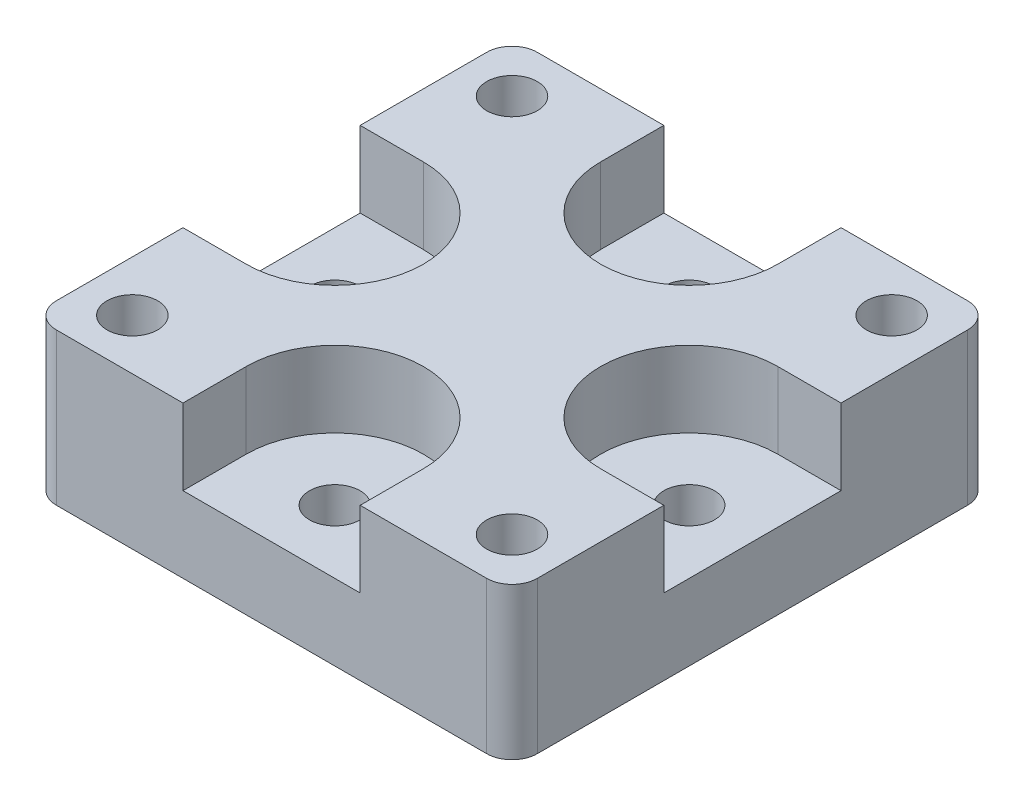
from build123d import *

# Parameters (mm, degrees)
SKETCH_1_W          = 19
SKETCH_1_H          = 19
SKETCH_1_R          = 1
EXTRUDE_1_DEPTH     = 6
FILLET_1_R          = 1
SKETCH_2_R          = 1
CUT_EXTRUDE_1_DEPTH = 28.531799796
CUT_EXTRUDE_2_DEPTH = 3


with BuildPart() as part:
    # Эскиз1 → Бобышка-Вытянуть1 (new body)
    with BuildSketch(Plane(origin=(0, 0, 0), x_dir=(1, 0, 0), z_dir=(0, 1, 0))):
        with Locations((9.5, 9.5)):
            Rectangle(SKETCH_1_W, SKETCH_1_H)
        with Locations(Location((2, 17, 0), (0, 0, 270))):
            Circle(SKETCH_1_R, mode=Mode.SUBTRACT)
        with Locations(Location((17, 17, 0), (0, 0, 270))):
            Circle(SKETCH_1_R, mode=Mode.SUBTRACT)
        with Locations(Location((17, 2, 0), (0, 0, 270))):
            Circle(SKETCH_1_R, mode=Mode.SUBTRACT)
        with Locations(Location((2, 2, 0), (0, 0, 270))):
            Circle(SKETCH_1_R, mode=Mode.SUBTRACT)
    extrude(amount=EXTRUDE_1_DEPTH)

    # Скругление1
    fillet_1_edges = [part.edges().sort_by_distance(p)[0] for p in [
        (0, 3, -19),
        (19, 3, -19),
        (19, 3, 0),
        (0, 3, 0),
    ]]
    fillet(fillet_1_edges, radius=FILLET_1_R)

    # Эскиз2 → Вырез-Вытянуть1 (cut, through all)
    with BuildSketch(Plane(origin=(0, 6, 0), x_dir=(1, 0, 0), z_dir=(0, 1, 0))):
        with Locations(Location((9.5, 16.5, 0), (0, 0, 270))):
            Circle(SKETCH_2_R)
        with Locations(Location((16.5, 9.5, 0), (0, 0, 270))):
            Circle(SKETCH_2_R)
        with Locations(Location((9.5, 2.5, 0), (0, 0, 270))):
            Circle(SKETCH_2_R)
        with Locations(Location((2.5, 9.5, 0), (0, 0, 270))):
            Circle(SKETCH_2_R)
    extrude(amount=-CUT_EXTRUDE_1_DEPTH, mode=Mode.SUBTRACT)

    # Эскиз3 → Вырез-Вытянуть2 (cut)
    with BuildSketch(Plane(origin=(0, 6, 0), x_dir=(1, 0, 0), z_dir=(0, 1, 0))):
        with BuildLine():
            Line((6, 16.5), (6, 21.9359466))
            Line((6, 21.9359466), (13, 21.9359466))
            Line((13, 21.9359466), (13, 16.5))
            ThreePointArc((13, 16.5), (9.5, 13), (6, 16.5))
        make_face()
        with BuildLine():
            Line((13, 2.5), (13, -5.102937302))
            Line((13, -5.102937302), (6, -4.799159297))
            Line((6, -4.799159297), (6, 2.5))
            ThreePointArc((6, 2.5), (9.5, 6), (13, 2.5))
        make_face()
        with BuildLine():
            Line((2.5, 6), (-3.698936954, 6))
            Line((-3.698936954, 6), (-3.698936954, 13))
            Line((-3.698936954, 13), (2.5, 13))
            ThreePointArc((2.5, 13), (6, 9.5), (2.5, 6))
        make_face()
        with BuildLine():
            Line((22.836899795, 13), (22.836899795, 6))
            Line((22.836899795, 6), (16.5, 6))
            ThreePointArc((16.5, 6), (13, 9.5), (16.5, 13))
            Line((16.5, 13), (22.836899795, 13))
        make_face()
    extrude(amount=-CUT_EXTRUDE_2_DEPTH, mode=Mode.SUBTRACT)


solid = part.part
